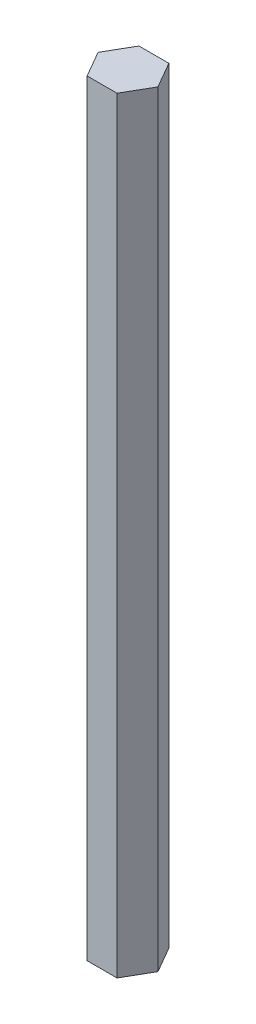
from build123d import *

# Parameters (mm, degrees)
BOSS_EXTRUDE1_DEPTH = 204.79


with BuildPart() as part:
    # Sketch1 → Boss-Extrude1 (new body)
    with BuildSketch(Plane(origin=(0, 0, 0), x_dir=(1, 0, 0), z_dir=(0, 1, 0))):
        Polygon((7.977059052, 1.579344013), (3.977059052, 8.507547244), (-4.022940948, 8.507547244), (-8.022940948, 1.579344013), (-4.022940948, -5.348859217), (3.977059052, -5.348859217), align=None)
    extrude(amount=BOSS_EXTRUDE1_DEPTH)


solid = part.part
